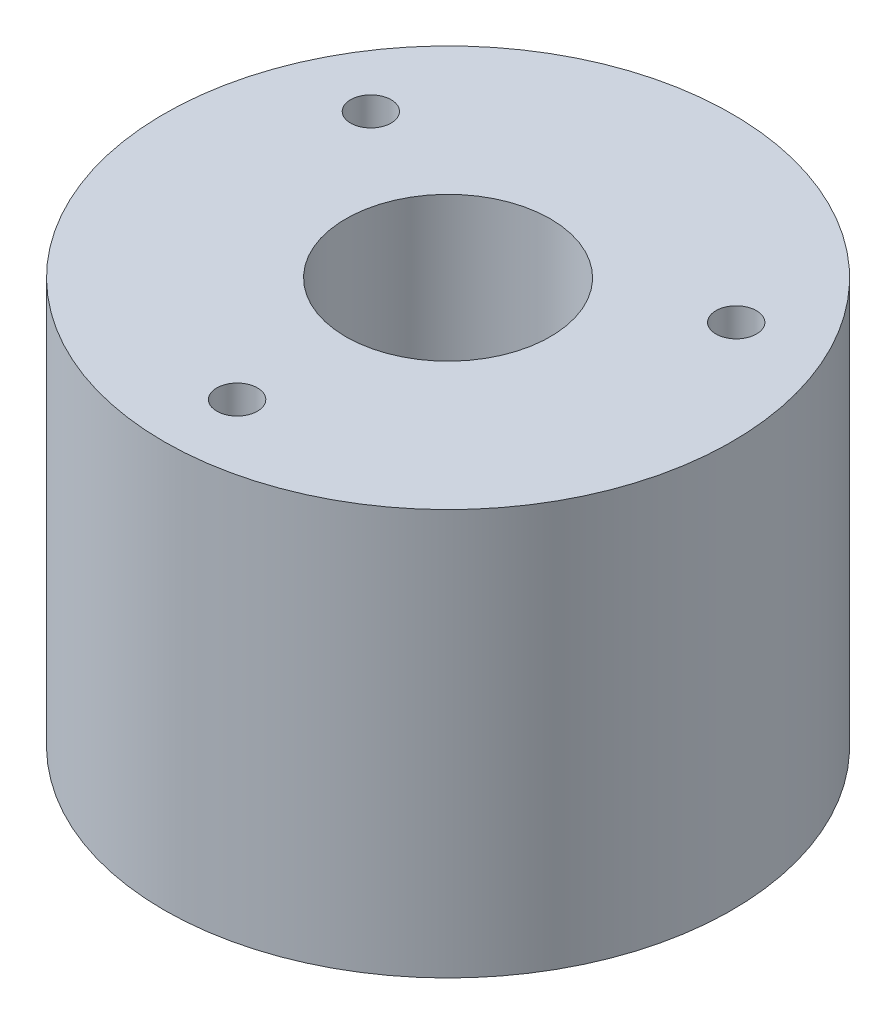
from build123d import *

# Parameters (mm, degrees)
SKETCH1_R           = 22.225
SKETCH1_R_2         = 8.001
BOSS_EXTRUDE1_DEPTH = 31.75
SKETCH2_R           = 1.5875
SKETCH2_R_2         = 8.001
CUT_EXTRUDE1_DEPTH  = 9.921875
FILLET1_R           = 3.175
SKETCH3_R           = 1.5875
CUT_EXTRUDE2_DEPTH  = 45.676210112


with BuildPart() as part:
    # Sketch1 → Boss-Extrude1 (new body)
    with BuildSketch(Plane(origin=(0, 0, 0), x_dir=(1, 0, 0), z_dir=(0, 1, 0))):
        with Locations(Location((0, 0, 0), (0, 0, 270))):
            Circle(SKETCH1_R)
        with Locations(Location((0, 0, 0), (0, 0, 270))):
            Circle(SKETCH1_R_2, mode=Mode.SUBTRACT)
    extrude(amount=BOSS_EXTRUDE1_DEPTH)

    # Sketch2 → Cut-Extrude1 (cut)
    # profile 1 of 31: a face of its own
    with BuildSketch(Plane.XZ):
        with BuildLine():
            ThreePointArc((-12.2555, 0), (-12.468184671, 0.79375), (-13.04925, 1.374815329))
            Line((-13.04925, 1.374815329), (-13.843, 0))
            Line((-13.843, 0), (-13.04925, -1.374815329))
            ThreePointArc((-13.04925, -1.374815329), (-12.468184671, -0.79375), (-12.2555, 0))
        make_face()
    # profile 2 of 31: a face of its own
    with BuildSketch(Plane.XZ):
        with BuildLine():
            Line((-13.843, 0), (-13.04925, 1.374815329))
            ThreePointArc((-13.04925, 1.374815329), (-15.4305, 0), (-13.04925, -1.374815329))
            Line((-13.04925, -1.374815329), (-13.843, 0))
        make_face()
    # profile 3 of 31: a face of its own
    with BuildSketch(Plane.XZ):
        with BuildLine():
            ThreePointArc((-12.2555, 0), (-12.468184671, 0.79375), (-13.04925, 1.374815329))
            Line((-13.04925, 1.374815329), (-13.843, 0))
            Line((-13.843, 0), (-13.04925, -1.374815329))
            ThreePointArc((-13.04925, -1.374815329), (-12.468184671, -0.79375), (-12.2555, 0))
        make_face()
    # profile 4 of 31: a face of its own
    with BuildSketch(Plane.XZ):
        with BuildLine():
            Line((-13.843, 0), (-13.04925, 1.374815329))
            ThreePointArc((-13.04925, 1.374815329), (-15.4305, 0), (-13.04925, -1.374815329))
            Line((-13.04925, -1.374815329), (-13.843, 0))
        make_face()
    # profile 5 of 31: a face of its own
    with BuildSketch(Plane.XZ):
        with Locations((-13.843, 0)):
            Circle(SKETCH2_R)
    # profile 6 of 31: a face of its own
    with BuildSketch(Plane.XZ):
        with Locations((-6.9215, -11.988389665)):
            Circle(SKETCH2_R)
    # profile 7 of 31: a face of its own
    with BuildSketch(Plane.XZ):
        with Locations((6.9215, -11.988389665)):
            Circle(SKETCH2_R)
    # profile 8 of 31: a face of its own
    with BuildSketch(Plane.XZ):
        with Locations((13.843, 0)):
            Circle(SKETCH2_R)
    # profile 9 of 31: a face of its own
    with BuildSketch(Plane.XZ):
        with Locations((6.9215, 11.988389665)):
            Circle(SKETCH2_R)
    # profile 10 of 31: a face of its own
    with BuildSketch(Plane.XZ):
        with Locations((-6.9215, 11.988389665)):
            Circle(SKETCH2_R)
    # profile 11 of 31: a face of its own
    with BuildSketch(Plane.XZ):
        Polygon((-13.843, 0), (-6.9215, -11.988389665), (6.9215, -11.988389665), (13.843, 0), (6.9215, 11.988389665), (-6.9215, 11.988389665), align=None)
        with Locations(Location((0, 0, 0), (0, 0, 270))):
            Circle(SKETCH2_R_2, mode=Mode.SUBTRACT)
    # profile 12 of 31: a face of its own
    with BuildSketch(Plane.XZ):
        with BuildLine():
            ThreePointArc((-5.334, -11.988389665), (-6.12775, -10.613574336), (-7.71525, -10.613574336))
            Line((-7.71525, -10.613574336), (-6.9215, -11.988389665))
            Line((-6.9215, -11.988389665), (-5.334, -11.988389665))
        make_face()
    # profile 13 of 31: a face of its own
    with BuildSketch(Plane.XZ):
        with BuildLine():
            Line((-6.9215, -11.988389665), (-7.71525, -10.613574336))
            ThreePointArc((-7.71525, -10.613574336), (-7.71525, -13.363204993), (-5.334, -11.988389665))
            Line((-5.334, -11.988389665), (-6.9215, -11.988389665))
        make_face()
    # profile 14 of 31: a face of its own
    with BuildSketch(Plane.XZ):
        with BuildLine():
            ThreePointArc((-5.334, -11.988389665), (-6.12775, -10.613574336), (-7.71525, -10.613574336))
            Line((-7.71525, -10.613574336), (-6.9215, -11.988389665))
            Line((-6.9215, -11.988389665), (-5.334, -11.988389665))
        make_face()
    # profile 15 of 31: a face of its own
    with BuildSketch(Plane.XZ):
        with BuildLine():
            Line((-6.9215, -11.988389665), (-7.71525, -10.613574336))
            ThreePointArc((-7.71525, -10.613574336), (-7.71525, -13.363204993), (-5.334, -11.988389665))
            Line((-5.334, -11.988389665), (-6.9215, -11.988389665))
        make_face()
    # profile 16 of 31: a face of its own
    with BuildSketch(Plane.XZ):
        with BuildLine():
            ThreePointArc((8.509, -11.988389665), (8.296315329, -11.194639665), (7.71525, -10.613574336))
            Line((7.71525, -10.613574336), (6.9215, -11.988389665))
            Line((6.9215, -11.988389665), (5.334, -11.988389665))
            ThreePointArc((5.334, -11.988389665), (6.9215, -13.575889665), (8.509, -11.988389665))
        make_face()
    # profile 17 of 31: a face of its own
    with BuildSketch(Plane.XZ):
        with BuildLine():
            Line((6.9215, -11.988389665), (7.71525, -10.613574336))
            ThreePointArc((7.71525, -10.613574336), (6.12775, -10.613574336), (5.334, -11.988389665))
            Line((5.334, -11.988389665), (6.9215, -11.988389665))
        make_face()
    # profile 18 of 31: a face of its own
    with BuildSketch(Plane.XZ):
        with BuildLine():
            ThreePointArc((8.509, -11.988389665), (8.296315329, -11.194639665), (7.71525, -10.613574336))
            Line((7.71525, -10.613574336), (6.9215, -11.988389665))
            Line((6.9215, -11.988389665), (5.334, -11.988389665))
            ThreePointArc((5.334, -11.988389665), (6.9215, -13.575889665), (8.509, -11.988389665))
        make_face()
    # profile 19 of 31: a face of its own
    with BuildSketch(Plane.XZ):
        with BuildLine():
            Line((6.9215, -11.988389665), (7.71525, -10.613574336))
            ThreePointArc((7.71525, -10.613574336), (6.12775, -10.613574336), (5.334, -11.988389665))
            Line((5.334, -11.988389665), (6.9215, -11.988389665))
        make_face()
    # profile 20 of 31: a face of its own
    with BuildSketch(Plane.XZ):
        with BuildLine():
            ThreePointArc((15.4305, 0), (14.63675, 1.374815329), (13.04925, 1.374815329))
            Line((13.04925, 1.374815329), (13.843, 0))
            Line((13.843, 0), (13.04925, -1.374815329))
            ThreePointArc((13.04925, -1.374815329), (14.63675, -1.374815329), (15.4305, 0))
        make_face()
    # profile 21 of 31: a face of its own
    with BuildSketch(Plane.XZ):
        with BuildLine():
            Line((13.843, 0), (13.04925, 1.374815329))
            ThreePointArc((13.04925, 1.374815329), (12.2555, 0), (13.04925, -1.374815329))
            Line((13.04925, -1.374815329), (13.843, 0))
        make_face()
    # profile 22 of 31: a face of its own
    with BuildSketch(Plane.XZ):
        with BuildLine():
            ThreePointArc((15.4305, 0), (14.63675, 1.374815329), (13.04925, 1.374815329))
            Line((13.04925, 1.374815329), (13.843, 0))
            Line((13.843, 0), (13.04925, -1.374815329))
            ThreePointArc((13.04925, -1.374815329), (14.63675, -1.374815329), (15.4305, 0))
        make_face()
    # profile 23 of 31: a face of its own
    with BuildSketch(Plane.XZ):
        with BuildLine():
            Line((13.843, 0), (13.04925, 1.374815329))
            ThreePointArc((13.04925, 1.374815329), (12.2555, 0), (13.04925, -1.374815329))
            Line((13.04925, -1.374815329), (13.843, 0))
        make_face()
    # profile 24 of 31: a face of its own
    with BuildSketch(Plane.XZ):
        with BuildLine():
            ThreePointArc((8.509, 11.988389665), (6.9215, 13.575889665), (5.334, 11.988389665))
            Line((5.334, 11.988389665), (6.9215, 11.988389665))
            Line((6.9215, 11.988389665), (7.71525, 10.613574336))
            ThreePointArc((7.71525, 10.613574336), (8.296315329, 11.194639665), (8.509, 11.988389665))
        make_face()
    # profile 25 of 31: a face of its own
    with BuildSketch(Plane.XZ):
        with BuildLine():
            Line((6.9215, 11.988389665), (5.334, 11.988389665))
            ThreePointArc((5.334, 11.988389665), (6.12775, 10.613574336), (7.71525, 10.613574336))
            Line((7.71525, 10.613574336), (6.9215, 11.988389665))
        make_face()
    # profile 26 of 31: a face of its own
    with BuildSketch(Plane.XZ):
        with BuildLine():
            ThreePointArc((8.509, 11.988389665), (6.9215, 13.575889665), (5.334, 11.988389665))
            Line((5.334, 11.988389665), (6.9215, 11.988389665))
            Line((6.9215, 11.988389665), (7.71525, 10.613574336))
            ThreePointArc((7.71525, 10.613574336), (8.296315329, 11.194639665), (8.509, 11.988389665))
        make_face()
    # profile 27 of 31: a face of its own
    with BuildSketch(Plane.XZ):
        with BuildLine():
            Line((6.9215, 11.988389665), (5.334, 11.988389665))
            ThreePointArc((5.334, 11.988389665), (6.12775, 10.613574336), (7.71525, 10.613574336))
            Line((7.71525, 10.613574336), (6.9215, 11.988389665))
        make_face()
    # profile 28 of 31: a face of its own
    with BuildSketch(Plane.XZ):
        with BuildLine():
            ThreePointArc((-7.71525, 10.613574336), (-6.12775, 10.613574336), (-5.334, 11.988389665))
            Line((-5.334, 11.988389665), (-6.9215, 11.988389665))
            Line((-6.9215, 11.988389665), (-7.71525, 10.613574336))
        make_face()
    # profile 29 of 31: a face of its own
    with BuildSketch(Plane.XZ):
        with BuildLine():
            Line((-6.9215, 11.988389665), (-5.334, 11.988389665))
            ThreePointArc((-5.334, 11.988389665), (-7.71525, 13.363204993), (-7.71525, 10.613574336))
            Line((-7.71525, 10.613574336), (-6.9215, 11.988389665))
        make_face()
    # profile 30 of 31: a face of its own
    with BuildSketch(Plane.XZ):
        with BuildLine():
            ThreePointArc((-7.71525, 10.613574336), (-6.12775, 10.613574336), (-5.334, 11.988389665))
            Line((-5.334, 11.988389665), (-6.9215, 11.988389665))
            Line((-6.9215, 11.988389665), (-7.71525, 10.613574336))
        make_face()
    # profile 31 of 31: a face of its own
    with BuildSketch(Plane.XZ):
        with BuildLine():
            Line((-6.9215, 11.988389665), (-5.334, 11.988389665))
            ThreePointArc((-5.334, 11.988389665), (-7.71525, 13.363204993), (-7.71525, 10.613574336))
            Line((-7.71525, 10.613574336), (-6.9215, 11.988389665))
        make_face()
    extrude(amount=-CUT_EXTRUDE1_DEPTH, mode=Mode.SUBTRACT)

    # Fillet1
    fillet1_edges = [part.edges().sort_by_distance(p)[0] for p in [
        (-5.334, 4.9609375, -11.988389665),
        (-7.71525, 4.9609375, -10.613574336),
        (-13.04925, 4.9609375, -1.374815329),
        (-13.04925, 4.9609375, 1.374815329),
        (-7.71525, 4.9609375, 10.613574336),
        (-5.334, 4.9609375, 11.988389665),
        (5.334, 4.9609375, 11.988389665),
        (7.71525, 4.9609375, 10.613574336),
        (13.04925, 4.9609375, 1.374815329),
        (13.04925, 4.9609375, -1.374815329),
        (7.71525, 4.9609375, -10.613574336),
        (5.334, 4.9609375, -11.988389665),
    ]]
    fillet(fillet1_edges, radius=FILLET1_R)

    # Sketch3 → Cut-Extrude2 (cut, through all)
    with BuildSketch(Plane.XZ):
        with Locations(Location((0, 16.51, 0), (0, 0, 270))):
            Circle(SKETCH3_R)
        with Locations(Location((14.298079416, -8.255, 0), (0, 0, 270))):
            Circle(SKETCH3_R)
        with Locations(Location((-14.298079416, -8.255, 0), (0, 0, 270))):
            Circle(SKETCH3_R)
    extrude(amount=-CUT_EXTRUDE2_DEPTH, mode=Mode.SUBTRACT)


solid = part.part
